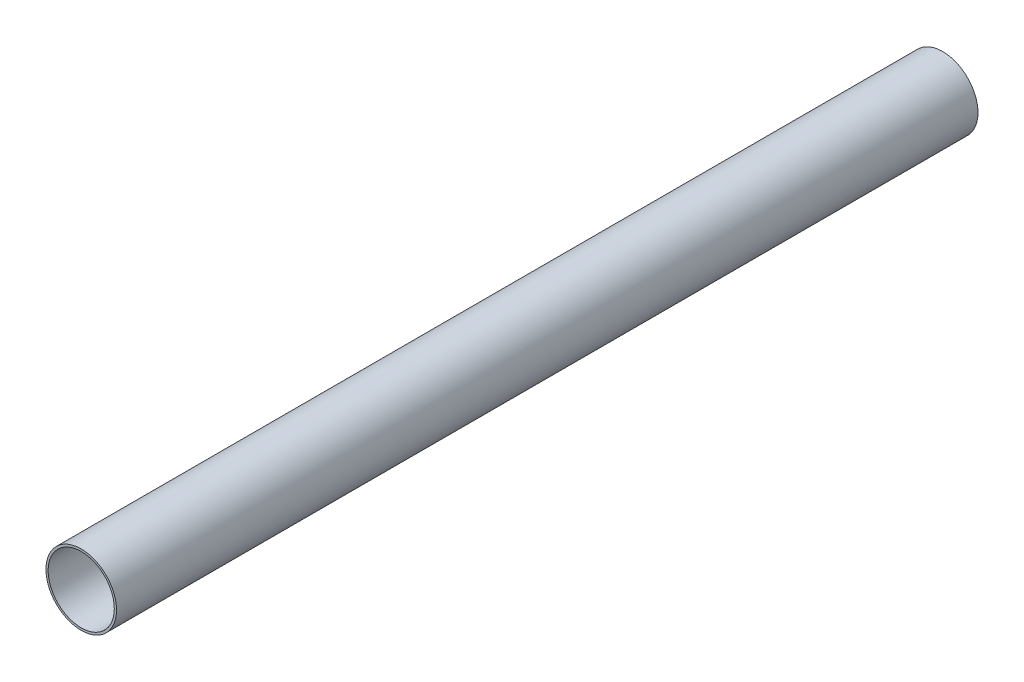
from build123d import *

# Parameters (mm, degrees)
SKETCH1_R           = 50.8381
SKETCH1_R_2         = 47.6631
BOSS_EXTRUDE1_DEPTH = 1241.2726


with BuildPart() as part:
    # Sketch1 → Boss-Extrude1 (new body)
    with BuildSketch(Plane.XY):
        Circle(SKETCH1_R)
        Circle(SKETCH1_R_2, mode=Mode.SUBTRACT)
    extrude(amount=BOSS_EXTRUDE1_DEPTH)


solid = part.part
